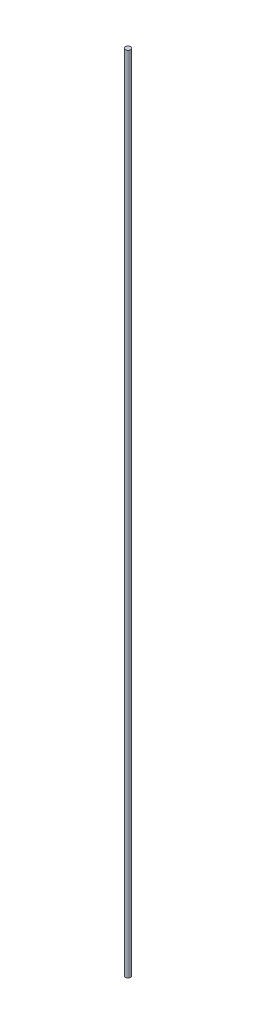
from build123d import *

# Parameters (mm, degrees)
SKETCH_2_W = 2.5
SKETCH_2_H = 760


with BuildPart() as part:
    # Эскиз2 → Повернуть1 (revolve)
    with BuildSketch(Plane.XY, mode=Mode.PRIVATE) as revolve_1_sk:
        with Locations((-1.25, 0)):
            Rectangle(SKETCH_2_W, SKETCH_2_H)
    revolve(revolve_1_sk.sketch.rotate(Axis((-2.5, 380, 0), (0, -1, 0)), 180), axis=Axis((-2.5, 380, 0), (0, -1, 0)))


solid = part.part
